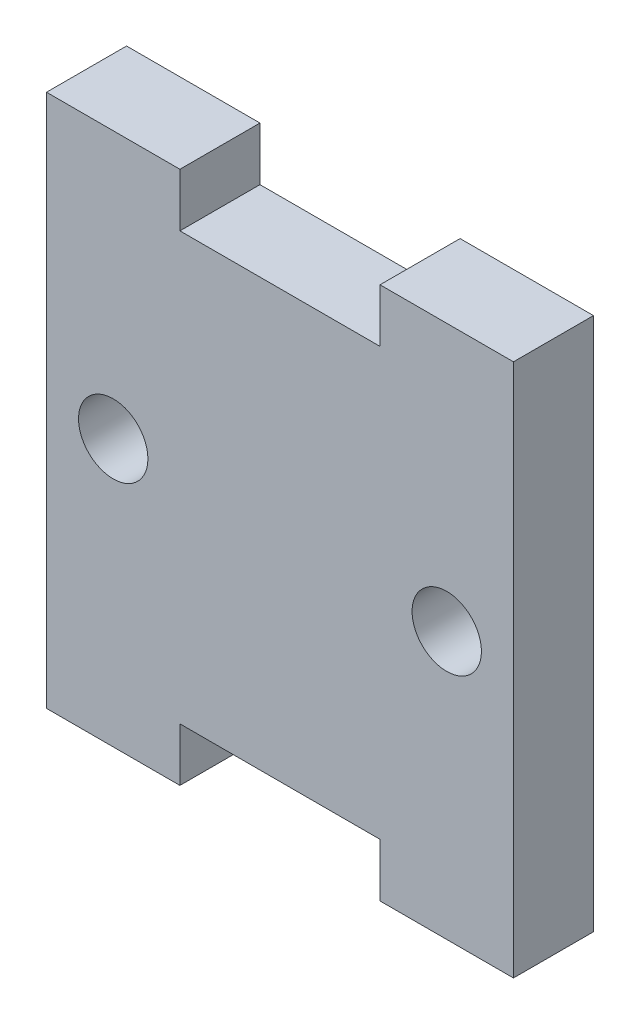
from build123d import *

# Parameters (mm, degrees)
ESBO_O1_W                = 10
ESBO_O1_H                = 4
ESBO_O1_W_2              = 35
ESBO_O1_H_2              = 32
ESBO_O1_R                = 2.6
RESSALTO_EXTRUS_O1_DEPTH = 6


with BuildPart() as part:
    # Esboço1 → Ressalto-extrusão1 (new body)
    # profile 1 of 5: a face of its own
    with BuildSketch(Plane.XY):
        with Locations((-12.5, -18)):
            Rectangle(ESBO_O1_W, ESBO_O1_H)
    # profile 2 of 5: a face of its own
    with BuildSketch(Plane.XY):
        Rectangle(ESBO_O1_W_2, ESBO_O1_H_2)
        with Locations((-12.5, 0)):
            Circle(ESBO_O1_R, mode=Mode.SUBTRACT)
        with Locations((12.5, 0)):
            Circle(ESBO_O1_R, mode=Mode.SUBTRACT)
    # profile 3 of 5: a face of its own
    with BuildSketch(Plane.XY):
        with Locations((12.5, -18)):
            Rectangle(ESBO_O1_W, ESBO_O1_H)
    # profile 4 of 5: a face of its own
    with BuildSketch(Plane.XY):
        with Locations((12.5, 18)):
            Rectangle(ESBO_O1_W, ESBO_O1_H)
    # profile 5 of 5: a face of its own
    with BuildSketch(Plane.XY):
        with Locations((-12.5, 18)):
            Rectangle(ESBO_O1_W, ESBO_O1_H)
    extrude(amount=RESSALTO_EXTRUS_O1_DEPTH)


solid = part.part
